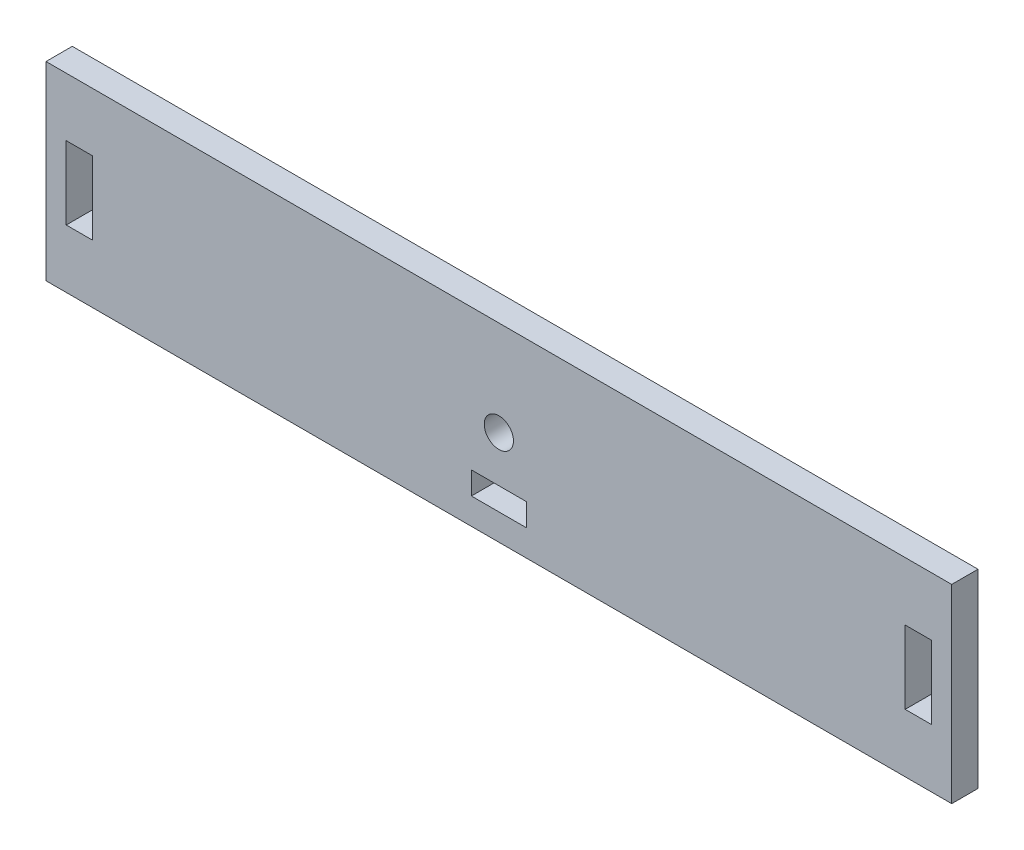
from build123d import *

# Parameters (mm, degrees)
SKETCH1_W           = 620
SKETCH1_H           = 130
SKETCH1_R           = 10
SKETCH1_W_2         = 18
SKETCH1_H_2         = 50
SKETCH1_W_3         = 37.615580966
SKETCH1_H_3         = 15.499548612
BOSS_EXTRUDE1_DEPTH = 18


with BuildPart() as part:
    # Sketch1 → Boss-Extrude1 (new body)
    with BuildSketch(Plane.XY):
        with Locations((310, -65)):
            Rectangle(SKETCH1_W, SKETCH1_H)
        with Locations((310, -65)):
            Circle(SKETCH1_R, mode=Mode.SUBTRACT)
        with Locations((22.856274172, -65)):
            Rectangle(SKETCH1_W_2, SKETCH1_H_2, mode=Mode.SUBTRACT)
        with Locations((310, -104.250225694)):
            Rectangle(SKETCH1_W_3, SKETCH1_H_3, mode=Mode.SUBTRACT)
        with Locations((597.143725828, -65)):
            Rectangle(SKETCH1_W_2, SKETCH1_H_2, mode=Mode.SUBTRACT)
    extrude(amount=BOSS_EXTRUDE1_DEPTH)


solid = part.part
